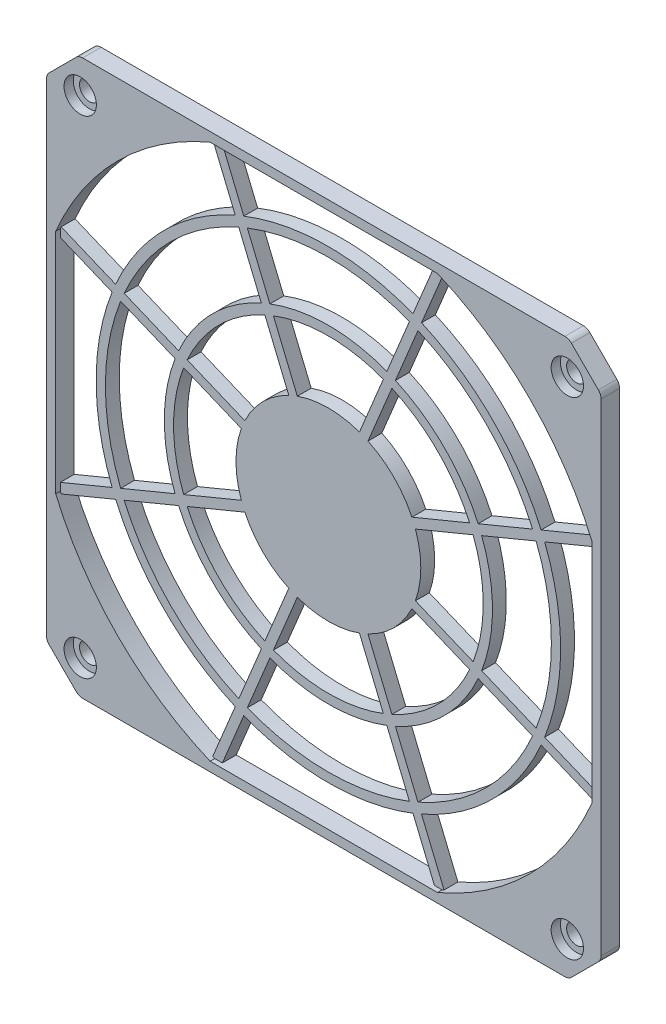
from build123d import *

# Parameters (mm, degrees)
SKETCH1_W           = 120
SKETCH1_H           = 120
SKETCH1_R           = 2.15
BOSS_EXTRUDE1_DEPTH = 4
CHAMFER1_SIZE       = 7
SKETCH2_R           = 20
BOSS_EXTRUDE2_DEPTH = 3
SKETCH3_R           = 50.25
SKETCH3_R_2         = 48.25
SKETCH3_R_3         = 35.5
SKETCH3_R_4         = 33.5
EXTRUDE_THIN1_DEPTH = 3
FILLET1_R           = 2
SKETCH4_R           = 3.5
CUT_EXTRUDE1_DEPTH  = 2


with BuildPart() as part:
    # Sketch1 → Boss-Extrude1 (new body)
    with BuildSketch(Plane.XY):
        Rectangle(SKETCH1_W, SKETCH1_H)
        with Locations((-52.7, 52.7)):
            Circle(SKETCH1_R, mode=Mode.SUBTRACT)
        with Locations((52.7, 52.7)):
            Circle(SKETCH1_R, mode=Mode.SUBTRACT)
        with Locations((-52.7, -52.7)):
            Circle(SKETCH1_R, mode=Mode.SUBTRACT)
        with Locations((52.7, -52.7)):
            Circle(SKETCH1_R, mode=Mode.SUBTRACT)
        with BuildLine():
            Line((-24.596747752, 58), (24.596747752, 58))
            ThreePointArc((24.596747752, 58), (44.547727215, 44.547727215), (58, 24.596747752))
            Line((58, 24.596747752), (58, -24.596747752))
            ThreePointArc((58, -24.596747752), (44.547727215, -44.547727215), (24.596747752, -58))
            Line((24.596747752, -58), (-24.596747752, -58))
            ThreePointArc((-24.596747752, -58), (-44.547727215, -44.547727215), (-58, -24.596747752))
            Line((-58, -24.596747752), (-58, 24.596747752))
            ThreePointArc((-58, 24.596747752), (-44.547727215, 44.547727215), (-24.596747752, 58))
        make_face(mode=Mode.SUBTRACT)
    extrude(amount=BOSS_EXTRUDE1_DEPTH)

    # Chamfer1
    chamfer1_edges = [part.edges().sort_by_distance(p)[0] for p in [
        (60, -60, 2),
        (-60, -60, 2),
        (-60, 60, 2),
        (60, 60, 2),
    ]]
    chamfer(chamfer1_edges, length=CHAMFER1_SIZE)



with BuildPart() as body_2:
    # Sketch2 → Boss-Extrude2 (new body)
    with BuildSketch(Plane.XY):
        Circle(SKETCH2_R)
    extrude(amount=BOSS_EXTRUDE2_DEPTH)


with BuildPart() as part_1:
    add(part.part)

    add(body_2.part)  # Extrude-Thin1 merges body 2
    # Sketch3 → Extrude-Thin1 (add)
    # profile 1 of 10: a face of its own
    with BuildSketch(Plane.XY):
        Circle(SKETCH3_R)
        Circle(SKETCH3_R_2, mode=Mode.SUBTRACT)
    # profile 2 of 10: a face of its own
    with BuildSketch(Plane.XY):
        Circle(SKETCH3_R_3)
        Circle(SKETCH3_R_4, mode=Mode.SUBTRACT)
    # profile 3 of 10: a face of its own
    with BuildSketch(Plane.XY):
        Polygon((7.620839599, 15.785208387), (25.12860663, 58.052696999), (23.280847565, 58.818063864), (5.773080534, 16.550575251), align=None)
    # profile 4 of 10: a face of its own
    with BuildSketch(Plane.XY):
        Polygon((16.550575251, 5.773080534), (58.818063864, 23.280847565), (58.052696999, 25.12860663), (15.785208387, 7.620839599), align=None)
    # profile 5 of 10: a face of its own
    with BuildSketch(Plane.XY):
        Polygon((15.785208387, -7.620839599), (58.052696999, -25.12860663), (58.818063864, -23.280847565), (16.550575251, -5.773080534), align=None)
    # profile 6 of 10: a face of its own
    with BuildSketch(Plane.XY):
        Polygon((5.773080534, -16.550575251), (23.280847565, -58.818063864), (25.12860663, -58.052696999), (7.620839599, -15.785208387), align=None)
    # profile 7 of 10: a face of its own
    with BuildSketch(Plane.XY):
        Polygon((-7.620839599, -15.785208387), (-25.12860663, -58.052696999), (-23.280847565, -58.818063864), (-5.773080534, -16.550575251), align=None)
    # profile 8 of 10: a face of its own
    with BuildSketch(Plane.XY):
        Polygon((-16.550575251, -5.773080534), (-58.818063864, -23.280847565), (-58.052696999, -25.12860663), (-15.785208387, -7.620839599), align=None)
    # profile 9 of 10: a face of its own
    with BuildSketch(Plane.XY):
        Polygon((-15.785208387, 7.620839599), (-58.052696999, 25.12860663), (-58.818063864, 23.280847565), (-16.550575251, 5.773080534), align=None)
    # profile 10 of 10: a face of its own
    with BuildSketch(Plane.XY):
        Polygon((-5.773080534, 16.550575251), (-23.280847565, 58.818063864), (-25.12860663, 58.052696999), (-7.620839599, 15.785208387), align=None)
    extrude(amount=EXTRUDE_THIN1_DEPTH)

    # Fillet1
    fillet1_edges = [part_1.edges().sort_by_distance(p)[0] for p in [
        (60, -53, 2),
        (60, 53, 2),
        (53, 60, 2),
        (-53, 60, 2),
        (-60, -53, 2),
        (-60, 53, 2),
        (-53, -60, 2),
        (53, -60, 2),
    ]]
    fillet(fillet1_edges, radius=FILLET1_R)

    # Sketch4 → Cut-Extrude1 (cut)
    with BuildSketch(Plane.XY.offset(4)):
        with Locations((-52.7, 52.7)):
            Circle(SKETCH4_R)
        with Locations((52.7, 52.7)):
            Circle(SKETCH4_R)
        with Locations((52.7, -52.7)):
            Circle(SKETCH4_R)
        with Locations((-52.7, -52.7)):
            Circle(SKETCH4_R)
    extrude(amount=-CUT_EXTRUDE1_DEPTH, mode=Mode.SUBTRACT)


solid = part_1.part
